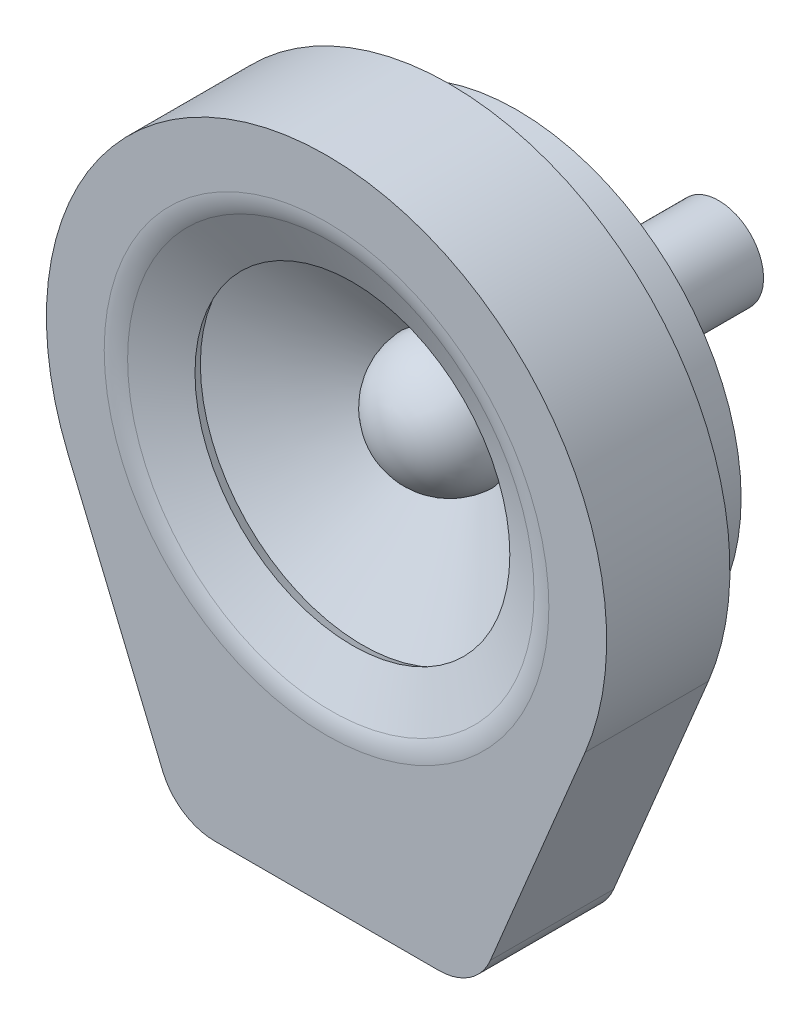
from build123d import *

# Parameters (mm, degrees)
EXTRUDE_THIN1_DEPTH = 5
SKETCH5_R           = 9.973205081
EXTRUDE1_DEPTH      = 0.5
FILLET1_R           = 2


with BuildPart() as part:
    # Sketch1 → Revolve1 (revolve)
    with BuildSketch(Plane(origin=(0, 0, 0), x_dir=(0, 0, -1), z_dir=(1, 0, 0)), mode=Mode.PRIVATE) as revolve1_sk:
        Polygon((0, 0), (12, 0), (12, 2), (3, 2), (3, 10), (0, 10), align=None)
    revolve(revolve1_sk.sketch.rotate(Axis((0, 0, 0), (0, 0, 1)), 90), axis=Axis((0, 0, 0), (0, 0, 1)))


with BuildPart() as body_2:
    # Sketch2 → Revolve-Thin2 (revolve)
    with BuildSketch(Plane(origin=(0, 0, 0), x_dir=(0, 0, -1), z_dir=(1, 0, 0))):
        with BuildLine():
            ThreePointArc((-2.778971463, 0), (-1.965029566, 1.965029566), (0, 2.778971463))
            Line((0, 2.778971463), (-3.5917125, 9))
            Line((-3.5917125, 9), (-3.5917125, 11))
            Line((-3.5917125, 11), (-3.6917125, 11))
            Line((-3.6917125, 11), (-3.6917125, 8.973205081))
            Line((-3.6917125, 8.973205081), (-0.170294669, 2.873930482))
            ThreePointArc((-0.170294669, 2.873930482), (-2.095083552, 1.974614291), (-2.878971463, 0))
            Line((-2.878971463, 0), (-2.778971463, 0))
        make_face()
    revolve(axis=Axis((0, 0, 0), (0, 0, 1)))


with BuildPart() as body_3:
    # Sketch4 → Extrude-Thin1 (new body)
    with BuildSketch(Plane.XY):
        with BuildLine():
            Line((7.309705434, -14.961177707), (11.539212944, -4.805888537))
            ThreePointArc((11.539212944, -4.805888537), (0, 12.5), (-11.539212944, -4.805888537))
            Line((-11.539212944, -4.805888537), (-7.309705434, -14.961177707))
            ThreePointArc((-7.309705434, -14.961177707), (-6.388775915, -16.08001734), (-5.001862845, -16.5))
            Line((-5.001862845, -16.5), (5.001862845, -16.5))
            ThreePointArc((5.001862845, -16.5), (6.388775915, -16.08001734), (7.309705434, -14.961177707))
        make_face()
        with BuildLine():
            Line((6.848136916, -14.768942166), (11.077644426, -4.613652995))
            ThreePointArc((11.077644426, -4.613652995), (0, 12), (-11.077644426, -4.613652995))
            Line((-11.077644426, -4.613652995), (-6.848136916, -14.768942166))
            ThreePointArc((-6.848136916, -14.768942166), (-6.111393301, -15.664013872), (-5.001862845, -16))
            Line((-5.001862845, -16), (5.001862845, -16))
            ThreePointArc((5.001862845, -16), (6.111393301, -15.664013872), (6.848136916, -14.768942166))
        make_face(mode=Mode.SUBTRACT)
    extrude(amount=EXTRUDE_THIN1_DEPTH)

    # Sketch5 → Extrude1 (add)
    with BuildSketch(Plane.XY.offset(5)):
        with BuildLine():
            Line((-11.539212944, -4.805888537), (-7.309705434, -14.961177707))
            ThreePointArc((-7.309705434, -14.961177707), (-6.388775915, -16.08001734), (-5.001862845, -16.5))
            Line((-5.001862845, -16.5), (5.001862845, -16.5))
            ThreePointArc((5.001862845, -16.5), (6.388775915, -16.08001734), (7.309705434, -14.961177707))
            Line((7.309705434, -14.961177707), (11.539212944, -4.805888537))
            ThreePointArc((11.539212944, -4.805888537), (0, 12.5), (-11.539212944, -4.805888537))
        make_face()
        Circle(SKETCH5_R, mode=Mode.SUBTRACT)
    extrude(amount=EXTRUDE1_DEPTH)

    # Sketch6 → Revolve-Thin3 (revolve)
    with BuildSketch(Plane(origin=(0, 0, 0), x_dir=(0, 0, -1), z_dir=(1, 0, 0)), mode=Mode.PRIVATE) as revolve_thin3_sk:
        Polygon((-5.5, 9.973205081), (-5.5, 9.473205081), (-4.345447499, 7.024699681), (-3.893202995, 7.237948147), (-5, 9.585176568), (-5, 9.973205081), align=None)
    revolve(revolve_thin3_sk.sketch.rotate(Axis((0, 0, 0), (0, 0, 1)), 90), axis=Axis((0, 0, 0), (0, 0, 1)))

    # Fillet1
    fillet1_edges = [body_3.edges().sort_by_distance(p)[0] for p in [
        (9.473205081, 0, 5.5),
    ]]
    fillet(fillet1_edges, radius=FILLET1_R)


solid = Compound([part.part, body_2.part, body_3.part])
